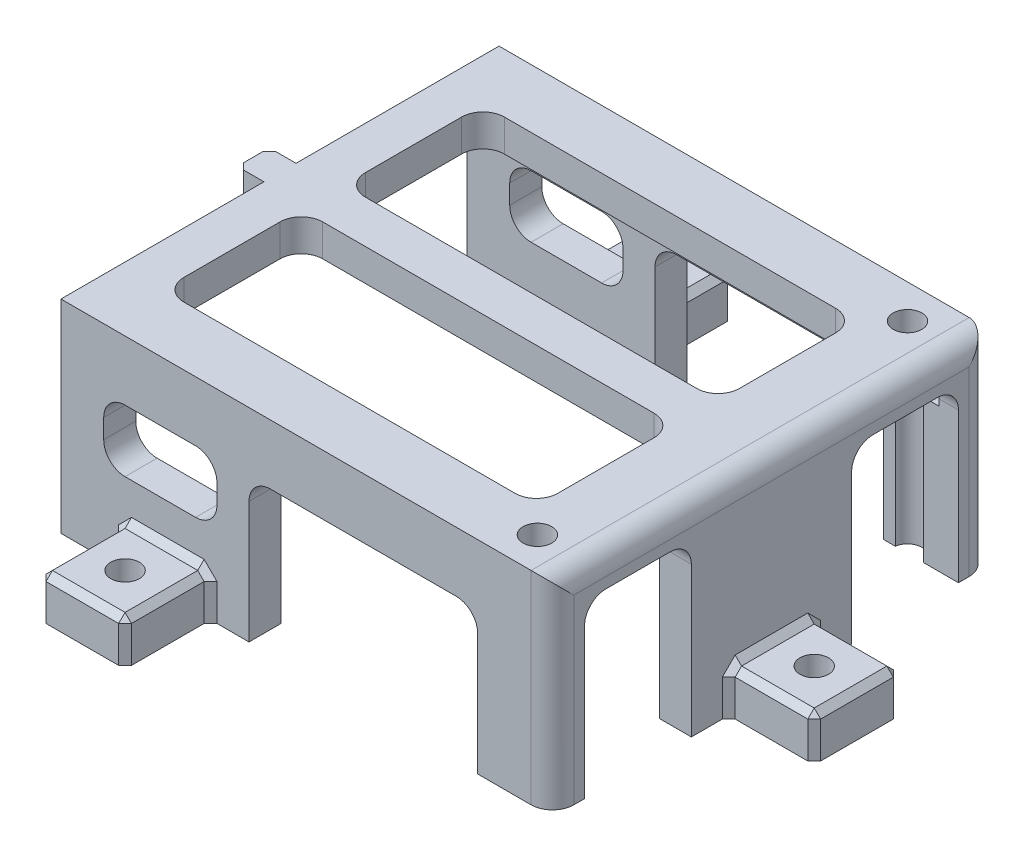
from build123d import *

# Parameters (mm, degrees)
BOSS_EXTRUDE1_DEPTH      = 20.32
SKETCH2_W                = 58.42
SKETCH2_H                = 52.07
BOSS_EXTRUDE2_DEPTH      = 3.81
SKETCH3_W                = 12.7
SKETCH3_H                = 20.32
CUT_EXTRUDE1_DEPTH       = 3.81
FILLET2_R                = 2.54
SKETCH4_W                = 10.16
SKETCH4_H                = 5.08
BOSS_EXTRUDE3_DEPTH      = 10.16
CHAMFER1_SIZE            = 0.762
SKETCH5_W                = 10.16
SKETCH5_H                = 5.08
BOSS_EXTRUDE4_DEPTH      = 10.16
CHAMFER2_SIZE            = 0.762
CHAMFER2_OF_MIRROR1_SIZE = 0.762
M3_CLEARANCE_HOLE1_D     = 3.4
M3_CLEARANCE_HOLE2_D     = 3.4
CUT_EXTRUDE2_REACH       = 61.966
SKETCH13_W               = 44.45
SKETCH13_H               = 16.51
SKETCH15_W               = 13.462
SKETCH15_H               = 7.366
CUT_EXTRUDE4_DEPTH       = 79.475827011
FILLET3_R                = 2.54
SKETCH16_W               = 6.35
SKETCH16_H               = 3.81
BOSS_EXTRUDE5_DEPTH      = 3.81
CHAMFER3_SIZE            = 0.762
M3_CLEARANCE_HOLE4_D     = 3.4
CUT_EXTRUDE5_DEPTH       = 3.302


with BuildPart() as part:
    # Sketch1 → Boss-Extrude1 (new body)
    with BuildSketch(Plane(origin=(0, 0, 0), x_dir=(1, 0, 0), z_dir=(0, 1, 0))):
        Polygon((-27.305, 22.225), (-27.305, 26.035), (31.115, 26.035), (31.115, -26.035), (-27.305, -26.035), (-27.305, -22.225), (27.305, -22.225), (27.305, 22.225), align=None)
    extrude(amount=BOSS_EXTRUDE1_DEPTH)

    # Sketch2 → Boss-Extrude2 (add)
    with BuildSketch(Plane(origin=(0, 20.32, 0), x_dir=(1, 0, 0), z_dir=(0, 1, 0))):
        with Locations((1.905, 0)):
            Rectangle(SKETCH2_W, SKETCH2_H)
    extrude(amount=BOSS_EXTRUDE2_DEPTH)

    # Sketch3 → Cut-Extrude1 (cut)
    with BuildSketch(Plane.ZY.offset(-27.305)):
        with Locations((-15.875, 10.16)):
            Rectangle(SKETCH3_W, SKETCH3_H)
        with Locations((15.875, 10.16)):
            Rectangle(SKETCH3_W, SKETCH3_H)
    extrude(amount=-CUT_EXTRUDE1_DEPTH, mode=Mode.SUBTRACT)

    # Fillet2
    fillet2_edges = [part.edges().sort_by_distance(p)[0] for p in [
        (31.115, 12.065, -26.035),
        (31.115, 12.065, 26.035),
        (31.115, 24.13, 0),
    ]]
    fillet(fillet2_edges, radius=FILLET2_R)

    # Sketch4 → Boss-Extrude3 (add)
    with BuildSketch(Plane(origin=(31.115, 0, 0), x_dir=(0, 0, -1), z_dir=(1, 0, 0))):
        with Locations((0, 2.54)):
            Rectangle(SKETCH4_W, SKETCH4_H)
    extrude(amount=BOSS_EXTRUDE3_DEPTH)

    # Chamfer1
    chamfer1_edges = [part.edges().sort_by_distance(p)[0] for p in [
        (31.115, 2.54, 5.08),
        (36.195, 5.08, 5.08),
        (31.115, 2.54, -5.08),
        (31.115, 5.08, 0),
        (36.195, 5.08, -5.08),
        (41.275, 2.54, 5.08),
        (41.275, 2.54, -5.08),
        (41.275, 5.08, 0),
    ]]
    chamfer(chamfer1_edges, length=CHAMFER1_SIZE)

    # Sketch5 → Boss-Extrude4 (add)
    with BuildSketch(Plane.XY.offset(26.035)):
        with Locations((-14.605, 2.54)):
            Rectangle(SKETCH5_W, SKETCH5_H)
    boss_extrude4 = extrude(amount=BOSS_EXTRUDE4_DEPTH)

    # Chamfer2
    chamfer2_edges = [part.edges().sort_by_distance(p)[0] for p in [
        (-19.685, 2.54, 26.035),
        (-19.685, 5.08, 31.115),
        (-9.525, 2.54, 26.035),
        (-14.605, 5.08, 26.035),
        (-9.525, 5.08, 31.115),
        (-19.685, 2.54, 36.195),
        (-9.525, 2.54, 36.195),
        (-14.605, 5.08, 36.195),
    ]]
    chamfer(chamfer2_edges, length=CHAMFER2_SIZE)

    # Mirror1: Boss-Extrude4 across plane
    add(boss_extrude4.mirror(Plane.XY))

    # Chamfer2 of Mirror1
    chamfer2_of_mirror1_edges = [part.edges().sort_by_distance(p)[0] for p in [
        (-19.685, 2.54, -26.035),
        (-19.685, 5.08, -31.115),
        (-9.525, 2.54, -26.035),
        (-14.605, 5.08, -26.035),
        (-9.525, 5.08, -31.115),
        (-19.685, 2.54, -36.195),
        (-9.525, 2.54, -36.195),
        (-14.605, 5.08, -36.195),
    ]]
    chamfer(chamfer2_of_mirror1_edges, length=CHAMFER2_OF_MIRROR1_SIZE)

    # M3 Clearance Hole1 (through all)
    with Locations(Plane(origin=(0, 5.08, 0), x_dir=(1, 0, 0), z_dir=(0, 1, 0))):
        with Locations((-14.605, -31.115)):
            m3_clearance_hole1 = Hole(M3_CLEARANCE_HOLE1_D / 2)

    # Mirror2: M3 Clearance Hole1 across plane
    add(m3_clearance_hole1.mirror(Plane.XY), mode=Mode.SUBTRACT)

    # M3 Clearance Hole2 (through all)
    with Locations(Plane(origin=(0, 5.08, 0), x_dir=(1, 0, 0), z_dir=(0, 1, 0))):
        with Locations((36.195, 0)):
            Hole(M3_CLEARANCE_HOLE2_D / 2)

    # Sketch13 → Cut-Extrude2 (cut, up to next)
    with BuildSketch(Plane(origin=(0, 24.13, 0), x_dir=(1, 0, 0), z_dir=(0, 1, 0)), mode=Mode.PRIVATE) as cut_extrude2_sk1:
        with Locations((0, -10.795)):
            Rectangle(SKETCH13_W, SKETCH13_H)
    cut_extrude2_tool1 = extrude(cut_extrude2_sk1.sketch, amount=-CUT_EXTRUDE2_REACH, mode=Mode.PRIVATE) & part.part
    # Sketch13 → Cut-Extrude2 (cut, up to next)
    with BuildSketch(Plane(origin=(0, 24.13, 0), x_dir=(1, 0, 0), z_dir=(0, 1, 0)), mode=Mode.PRIVATE) as cut_extrude2_sk2:
        with Locations((0, 10.795)):
            Rectangle(SKETCH13_W, SKETCH13_H)
    cut_extrude2_tool2 = extrude(cut_extrude2_sk2.sketch, amount=-CUT_EXTRUDE2_REACH, mode=Mode.PRIVATE) & part.part
    add(cut_extrude2_tool1.solids().sort_by_distance((0, 24.13, 10.795))[0], mode=Mode.SUBTRACT)
    add(cut_extrude2_tool2.solids().sort_by_distance((0, 24.13, -10.795))[0], mode=Mode.SUBTRACT)

    # Sketch15 → Cut-Extrude4 (cut, through all)
    with BuildSketch(Plane(origin=(0, 0, -26.035), x_dir=(-1, 0, 0), z_dir=(0, 0, -1))):
        Polygon((-22.225, 0), (4.953, 0), (4.953, 9.652), (4.953, 17.018), (2.441043817, 17.018), (-22.225, 17.018), align=None)
        with Locations((15.494, 13.335)):
            Rectangle(SKETCH15_W, SKETCH15_H)
    extrude(amount=-CUT_EXTRUDE4_DEPTH, mode=Mode.SUBTRACT)

    # Fillet3
    fillet3_edges = [part.edges().sort_by_distance(p)[0] for p in [
        (-22.225, 22.225, 19.05),
        (-22.225, 22.225, 2.54),
        (1.905, 20.32, -22.225),
        (22.225, 22.225, 2.54),
        (22.225, 22.225, 19.05),
        (22.225, 22.225, -19.05),
        (22.225, 22.225, -2.54),
        (-22.225, 22.225, -2.54),
        (-22.225, 22.225, -19.05),
        (22.225, 17.018, 24.13),
        (22.225, 17.018, -24.13),
        (-4.953, 17.018, 24.13),
        (-4.953, 17.018, -24.13),
        (-22.225, 17.018, 24.13),
        (-22.225, 17.018, -24.13),
        (-22.225, 9.652, 24.13),
        (-22.225, 9.652, -24.13),
        (-8.763, 9.652, 24.13),
        (-8.763, 9.652, -24.13),
        (-8.763, 17.018, 24.13),
        (-8.763, 17.018, -24.13),
        (29.21, 20.32, -9.525),
        (29.21, 20.32, 9.525),
        (1.905, 20.32, 22.225),
    ]]
    fillet(fillet3_edges, radius=FILLET3_R)

    # Sketch16 → Boss-Extrude5 (add)
    with BuildSketch(Plane(origin=(0, 24.13, 0), x_dir=(1, 0, 0), z_dir=(0, 1, 0))):
        with Locations((-27.305, 0)):
            Rectangle(SKETCH16_W, SKETCH16_H)
    extrude(amount=-BOSS_EXTRUDE5_DEPTH)

    # Chamfer3
    chamfer3_edges = [part.edges().sort_by_distance(p)[0] for p in [
        (-28.8925, 20.32, -1.905),
        (-28.8925, 20.32, 1.905),
        (-30.48, 20.32, 0),
        (-30.48, 22.225, -1.905),
        (-30.48, 22.225, 1.905),
    ]]
    chamfer(chamfer3_edges, length=CHAMFER3_SIZE)

    # M3 Clearance Hole4 (through all)
    with Locations(Plane(origin=(0, 24.13, 0), x_dir=(1, 0, 0), z_dir=(0, 1, 0))):
        with Locations((25.286866606, -21.9964), (25.286866606, 21.9964)):
            Hole(M3_CLEARANCE_HOLE4_D / 2)

    # Sketch22 → Cut-Extrude5 (cut)
    with BuildSketch(Plane.XZ.offset(-20.32)):
        Polygon((28.953040816, 21.9964), (27.119953711, 25.1714), (23.453779502, 25.1714), (21.620692397, 21.9964), (23.453779502, 18.8214), (27.119953711, 18.8214), align=None)
        Polygon((28.953040816, -21.9964), (27.119953711, -18.8214), (23.453779502, -18.8214), (21.620692397, -21.9964), (23.453779502, -25.1714), (27.119953711, -25.1714), align=None)
    extrude(amount=CUT_EXTRUDE5_DEPTH, mode=Mode.SUBTRACT)


solid = part.part
